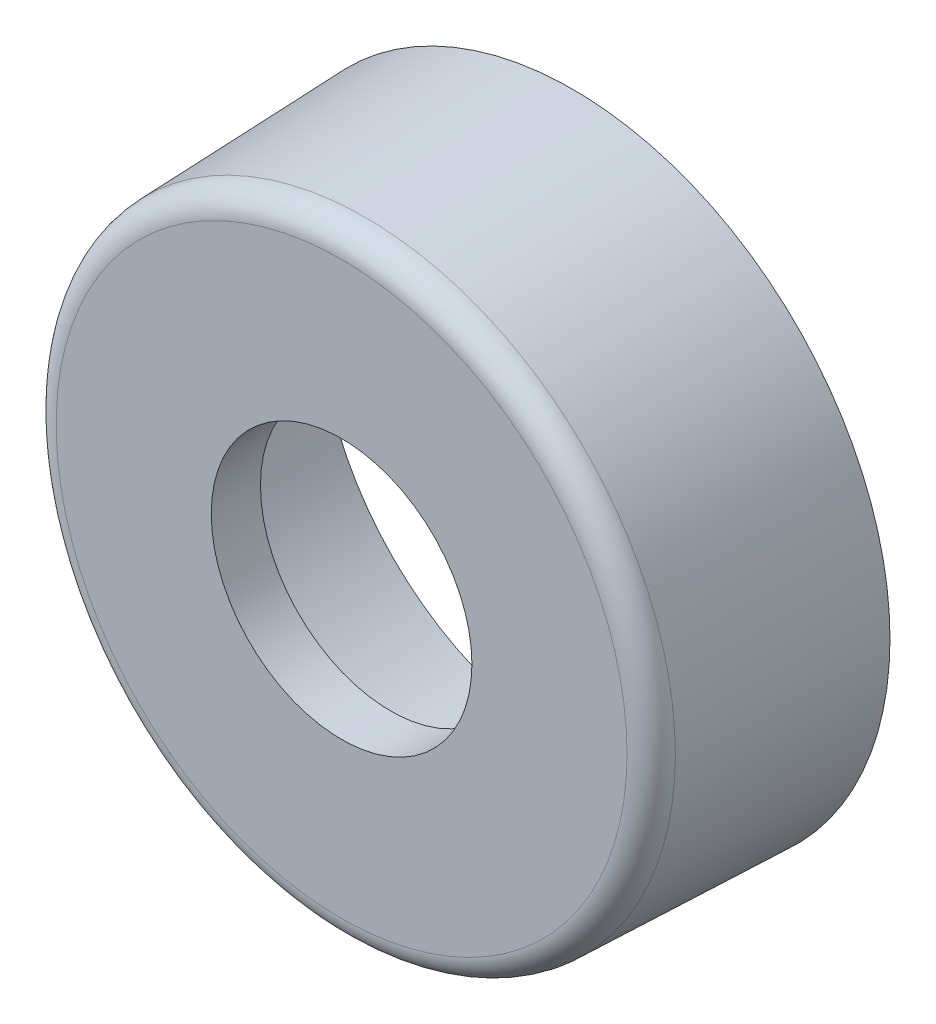
from build123d import *

# Parameters (mm, degrees)
ESQUISSE1_R        = 6.45
ESQUISSE1_R_2      = 5.15
BOSS_EXTRU_1_DEPTH = 4.7
BOSS_EXTRU_1_DRAFT = 2
ESQUISSE2_R        = 6.285872383
ESQUISSE2_R_2      = 2.65
BOSS_EXTRU_2_DEPTH = 1
CONG_1_R           = 0.5


with BuildPart() as part:
    # Esquisse1 → Boss.-Extru.1 (with draft: the straight prism first)
    with BuildSketch(Plane.XY):
        Circle(ESQUISSE1_R)
        Circle(ESQUISSE1_R_2, mode=Mode.SUBTRACT)
    extrude(amount=BOSS_EXTRU_1_DEPTH)
    # Boss.-Extru.1: the draft: its side faces are tilted about the plane it starts from
    boss_extru_1_sides = [part.faces().sort_by_distance(p)[0] for p in [
        (-6.45, 0, 2.35),
        (-5.15, 0, 2.35),
    ]]
    draft(boss_extru_1_sides, Plane.XY, BOSS_EXTRU_1_DRAFT)

    # Esquisse2 → Boss.-Extru.2 (add)
    with BuildSketch(Plane.XY.offset(4.7)):
        Circle(ESQUISSE2_R)
        Circle(ESQUISSE2_R_2, mode=Mode.SUBTRACT)
    extrude(amount=-BOSS_EXTRU_2_DEPTH)

    # Congé1
    cong_1_edges = [part.edges().sort_by_distance(p)[0] for p in [
        (-6.285872383, 0, 4.7),
    ]]
    fillet(cong_1_edges, radius=CONG_1_R)


solid = part.part
